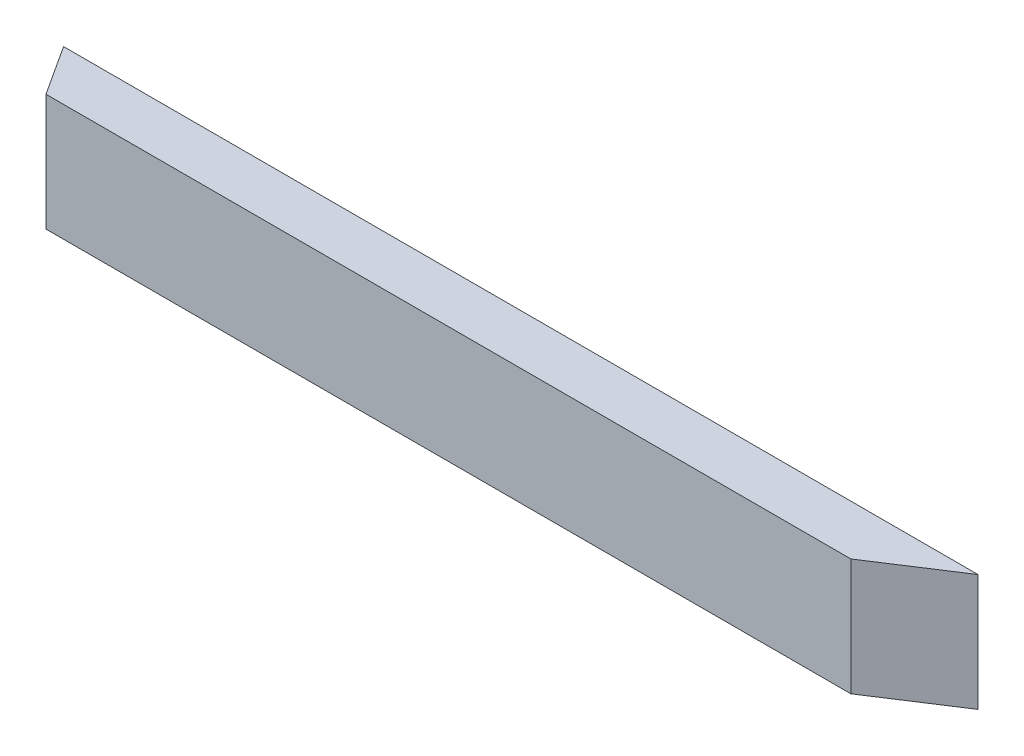
from build123d import *

# Parameters (mm, degrees)
BOSS_EXTRUDE1_DEPTH = 88.9


with BuildPart() as part:
    # Sketch1 → Boss-Extrude1 (new body)
    with BuildSketch(Plane(origin=(0, 0, 0), x_dir=(1, 0, 0), z_dir=(0, 1, 0))):
        Polygon((0, 0), (695.96, 0), (637.291144879, -38.1), (24.742429301, -38.1), align=None)
    extrude(amount=BOSS_EXTRUDE1_DEPTH)


solid = part.part
